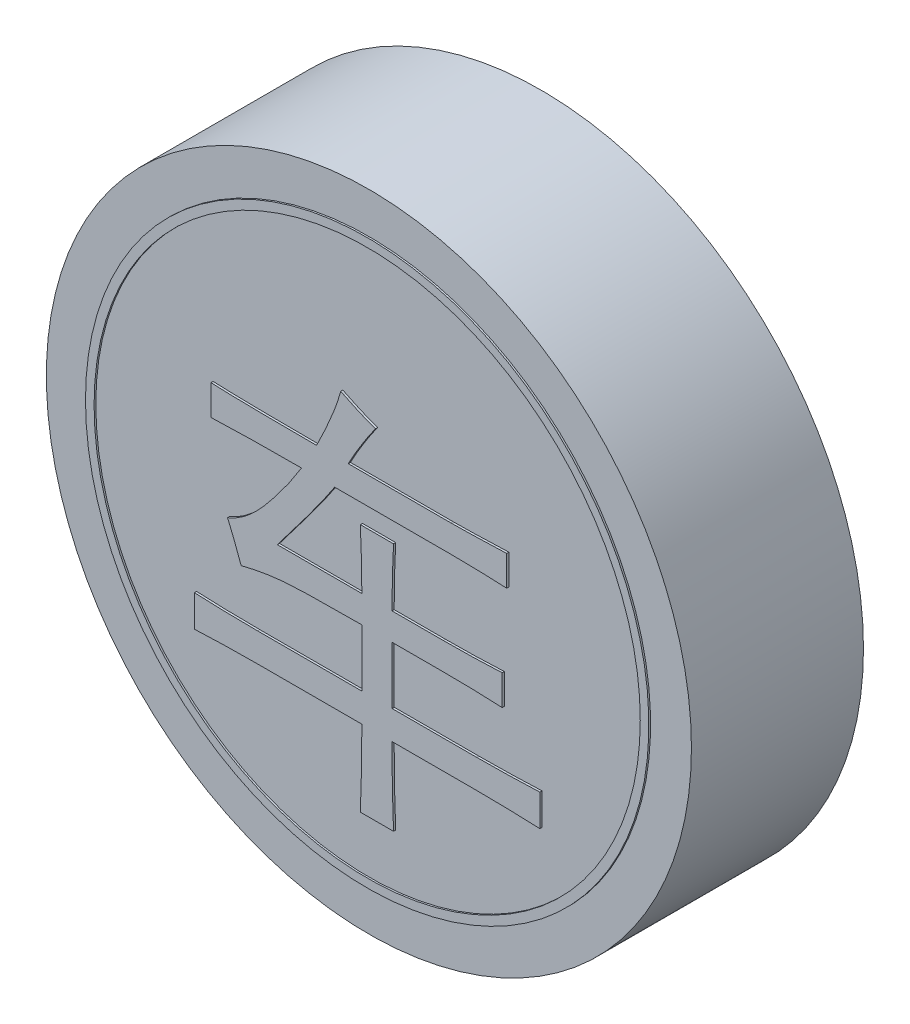
from build123d import *

# Parameters (mm, degrees)
SKETCH_1_R               = 15
DIAMETER30_HEIGHT8_DEPTH = 8
CHARACTER_DEPTH          = 0.1
SKETCH_3_R               = 13.1
SKETCH_3_R_2             = 12.7
INK_RING_DEPTH           = 0.08


with BuildPart() as part:
    # 草图1 → Diameter30_Height8 (new body)
    with BuildSketch(Plane.XY):
        Circle(SKETCH_1_R)
    extrude(amount=-DIAMETER30_HEIGHT8_DEPTH)

    # 草图2 → Character_车 (add)
    with BuildSketch(Plane.XY):
        with BuildLine():
            add(Edge.make_bspline(
                [(-5.842105263, -3.026315789), (-5.898820329, -2.869331425), (-6.006873714, -2.570245254), (-6.168804206, -2.144780878), (-6.320461844, -1.762772614), (-6.42455933, -1.524652502), (-6.473684211, -1.412280702)],
                knots=[0, 0, 0, 0, 1.155372541, 2.201212519, 3.151130129, 4, 4, 4, 4], degree=3))
            add(Edge.make_bspline(
                [(-6.473684211, -1.412280702), (-6.396823444, -1.379800087), (-6.239919961, -1.313494196), (-6.010146568, -1.186156652), (-5.778564765, -1.035723149), (-5.547823353, -0.856912408), (-5.313044861, -0.657208498), (-5.079209262, -0.430138074), (-4.845963085, -0.176973346), (-4.534501394, 0.18732381), (-4.164145867, 0.656391458), (-3.748633816, 1.216101595), (-3.371664409, 1.762234908), (-3.145394749, 2.128474715), (-3.035087719, 2.307017544)],
                knots=[0, 0, 0, 0, 0.584208733, 1.192603045, 1.837360117, 2.517159342, 3.236043131, 3.995784846, 4.79889664, 5.646810753, 7.353001509, 8.984483524, 10.529928116, 12, 12, 12, 12], degree=3))
            add(Edge.make_bspline(
                [(-3.035087719, 2.307017544), (-3.246482619, 2.307526273), (-3.658883418, 2.308518731), (-4.261856974, 2.301476847), (-4.833674599, 2.297370313), (-5.375169247, 2.289752816), (-5.886281193, 2.27816959), (-6.367224064, 2.269967872), (-6.816777836, 2.252736276), (-7.106129451, 2.242011892), (-7.245614035, 2.236842105)],
                knots=[0, 0, 0, 0, 1.204686206, 2.35016811, 3.436405474, 4.463457902, 5.436294372, 6.34989698, 7.204552796, 8, 8, 8, 8], degree=3))
            Line((-7.245614035, 2.236842105), (-7.245614035, 3.640350877))
            add(Edge.make_bspline(
                [(-7.245614035, 3.640350877), (-7.112197092, 3.635099441), (-6.825465539, 3.623813374), (-6.364629063, 3.606862837), (-5.842966328, 3.598841349), (-5.259942843, 3.587169275), (-4.61534822, 3.57975231), (-3.909248078, 3.575626696), (-3.141661522, 3.568632873), (-2.609705057, 3.569648027), (-2.333333333, 3.570175439)],
                knots=[0, 0, 0, 0, 0.652233806, 1.401741091, 2.25255631, 3.200691931, 4.250322975, 5.401478114, 6.649968519, 8, 8, 8, 8], degree=3))
            add(Edge.make_bspline(
                [(-2.333333333, 3.570175439), (-2.265182445, 3.706781651), (-2.13249513, 3.972749008), (-1.948730322, 4.364802108), (-1.781805751, 4.736299128), (-1.633474827, 5.088418502), (-1.500571846, 5.419860952), (-1.385562669, 5.732537711), (-1.288604233, 6.025373857), (-1.235803724, 6.215836544), (-1.210526316, 6.307017544)],
                knots=[0, 0, 0, 0, 1.236548776, 2.407515765, 3.506966959, 4.535340541, 5.502281012, 6.399229081, 7.23365623, 8, 8, 8, 8], degree=3))
            add(Edge.make_bspline(
                [(-1.210526316, 6.307017544), (-1.072464078, 6.238250423), (-0.801072324, 6.103073492), (-0.390506761, 5.92371698), (0.006858558, 5.752049753), (0.273104458, 5.653521307), (0.403508772, 5.605263158)],
                knots=[0, 0, 0, 0, 1.050893361, 2.065762486, 3.052631741, 4, 4, 4, 4], degree=3))
            add(Edge.make_bspline(
                [(0.403508772, 5.605263158), (0.287716291, 5.440743002), (0.057094455, 5.113071117), (-0.262779106, 4.605286149), (-0.575699306, 4.095748706), (-0.765073243, 3.745229449), (-0.859649123, 3.570175439)],
                knots=[0, 0, 0, 0, 1.007065107, 2.005753766, 3.00404673, 4, 4, 4, 4], degree=3))
            Line((-0.859649123, 3.570175439), (3.912280702, 3.570175439))
            add(Edge.make_bspline(
                [(3.912280702, 3.570175439), (3.986792128, 3.569779735), (4.146229603, 3.568933021), (4.399164705, 3.576215116), (4.681635542, 3.580205028), (4.991801347, 3.588183635), (5.330489118, 3.599673551), (5.697948203, 3.608156571), (6.093748619, 3.625727153), (6.367546823, 3.635374682), (6.50877193, 3.640350877)],
                knots=[0, 0, 0, 0, 0.688397439, 1.473013676, 2.337661006, 3.298515698, 4.339608953, 5.468714639, 6.694363069, 8, 8, 8, 8], degree=3))
            Line((6.50877193, 3.640350877), (6.50877193, 2.236842105))
            add(Edge.make_bspline(
                [(6.50877193, 2.236842105), (6.279214943, 2.247975922), (5.82888106, 2.269817709), (5.1668562, 2.289395513), (4.530922728, 2.303382911), (4.115883288, 2.305821342), (3.912280702, 2.307017544)],
                knots=[0, 0, 0, 0, 1.061662981, 2.082719505, 3.05945501, 4, 4, 4, 4], degree=3))
            Line((3.912280702, 2.307017544), (-1.49122807, 2.307017544))
            add(Edge.make_bspline(
                [(-1.49122807, 2.307017544), (-1.56117399, 2.201167925), (-1.710872673, 1.974627926), (-1.95506101, 1.616085811), (-2.235185889, 1.218787258), (-2.555254083, 0.784910796), (-2.903437302, 0.30729052), (-3.289360757, -0.207943656), (-3.711097719, -0.76191269), (-4.005224498, -1.143853854), (-4.157894737, -1.342105263)],
                knots=[0, 0, 0, 0, 0.673545103, 1.441525336, 2.302896076, 3.254132591, 4.303779702, 5.440759354, 6.671593656, 8, 8, 8, 8], degree=3))
            Line((-4.157894737, -1.342105263), (-0.228070175, -1.342105263))
            add(Edge.make_bspline(
                [(-0.228070175, -1.342105263), (-0.231461537, -0.891528138), (-0.238331174, 0.021173694), (-0.278106388, 0.933036802), (-0.298245614, 1.394736842)],
                knots=[0, 0, 0, 0, 0.987347913, 2, 2, 2, 2], degree=3))
            Line((-0.298245614, 1.394736842), (1.245614035, 1.394736842))
            add(Edge.make_bspline(
                [(1.245614035, 1.394736842), (1.234342441, 1.188579897), (1.211003525, 0.761712205), (1.192285381, 0.099612341), (1.178632375, -0.606505386), (1.176525709, -1.091718406), (1.175438596, -1.342105263)],
                knots=[0, 0, 0, 0, 0.904818853, 1.873514066, 2.902659025, 4, 4, 4, 4], degree=3))
            Line((1.175438596, -1.342105263), (3.561403509, -1.342105263))
            add(Edge.make_bspline(
                [(3.561403509, -1.342105263), (4.023251472, -1.338996907), (4.935977079, -1.332854028), (5.847809296, -1.292074512), (6.298245614, -1.271929825)],
                knots=[0, 0, 0, 0, 1.012019295, 2, 2, 2, 2], degree=3))
            Line((6.298245614, -1.271929825), (6.298245614, -2.675438596))
            add(Edge.make_bspline(
                [(6.298245614, -2.675438596), (5.847809296, -2.655293909), (4.935977079, -2.614514393), (4.023251472, -2.608371514), (3.561403509, -2.605263158)],
                knots=[0, 0, 0, 0, 0.987980705, 2, 2, 2, 2], degree=3))
            Line((3.561403509, -2.605263158), (1.175438596, -2.605263158))
            Line((1.175438596, -2.605263158), (1.175438596, -5.271929825))
            Line((1.175438596, -5.271929825), (5.105263158, -5.271929825))
            add(Edge.make_bspline(
                [(5.105263158, -5.271929825), (5.333122844, -5.270715306), (5.801003783, -5.268221447), (6.520106526, -5.254311899), (7.274811493, -5.234595053), (7.789282241, -5.212873368), (8.052631579, -5.201754386)],
                knots=[0, 0, 0, 0, 0.927389459, 1.904276523, 2.92723271, 4, 4, 4, 4], degree=3))
            Line((8.052631579, -5.201754386), (8.052631579, -6.675438596))
            add(Edge.make_bspline(
                [(8.052631579, -6.675438596), (7.789282241, -6.664319614), (7.274811493, -6.64259793), (6.520106526, -6.622881083), (5.801003783, -6.608971535), (5.333122844, -6.606477676), (5.105263158, -6.605263158)],
                knots=[0, 0, 0, 0, 1.07276729, 2.095723477, 3.072610541, 4, 4, 4, 4], degree=3))
            Line((5.105263158, -6.605263158), (1.175438596, -6.605263158))
            add(Edge.make_bspline(
                [(1.175438596, -6.605263158), (1.17492319, -6.788068469), (1.173921664, -7.143291287), (1.180988322, -7.662224869), (1.185055025, -8.151741366), (1.192680502, -8.613534144), (1.204276819, -9.04666503), (1.212388046, -9.451393023), (1.229724118, -9.827285169), (1.240445713, -10.06811771), (1.245614035, -10.184210526)],
                knots=[0, 0, 0, 0, 1.225493371, 2.381348807, 3.479127077, 4.507295234, 5.477513674, 6.383863443, 7.220944797, 8, 8, 8, 8], degree=3))
            Line((1.245614035, -10.184210526), (-0.298245614, -10.184210526))
            add(Edge.make_bspline(
                [(-0.298245614, -10.184210526), (-0.293088467, -10.062919018), (-0.28244323, -9.812552555), (-0.26517016, -9.425394066), (-0.256955584, -9.014609066), (-0.245308677, -8.579745809), (-0.237743343, -8.120551737), (-0.233625145, -7.637100266), (-0.226569426, -7.129429714), (-0.227561666, -6.782870303), (-0.228070175, -6.605263158)],
                knots=[0, 0, 0, 0, 0.813876, 1.679979569, 2.597948426, 3.568174058, 4.596349836, 5.676713029, 6.809345956, 8, 8, 8, 8], degree=3))
            Line((-0.228070175, -6.605263158), (-5.070175439, -6.605263158))
            add(Edge.make_bspline(
                [(-5.070175439, -6.605263158), (-5.324893201, -6.606388994), (-5.827429759, -6.608610173), (-6.573394245, -6.622429105), (-7.301292576, -6.641441143), (-7.781058, -6.664213602), (-8.01754386, -6.675438596)],
                knots=[0, 0, 0, 0, 1.036669794, 2.04526165, 3.036470834, 4, 4, 4, 4], degree=3))
            Line((-8.01754386, -6.675438596), (-8.01754386, -5.201754386))
            add(Edge.make_bspline(
                [(-8.01754386, -5.201754386), (-7.781058, -5.212979381), (-7.301292576, -5.235751839), (-6.573394245, -5.254763877), (-5.827429759, -5.268582809), (-5.324893201, -5.270803988), (-5.070175439, -5.271929825)],
                knots=[0, 0, 0, 0, 0.963529166, 1.95473835, 2.963330206, 4, 4, 4, 4], degree=3))
            Line((-5.070175439, -5.271929825), (-0.228070175, -5.271929825))
            Line((-0.228070175, -5.271929825), (-0.228070175, -2.605263158))
            add(Edge.make_bspline(
                [(-0.228070175, -2.605263158), (-0.430801667, -2.604732204), (-0.819811605, -2.603713387), (-1.378600845, -2.610674903), (-1.888907343, -2.614839935), (-2.351576194, -2.622216615), (-2.76650508, -2.633903903), (-3.133156573, -2.641670696), (-3.450969213, -2.659258343), (-3.813777921, -2.677582124), (-4.243119388, -2.723022723), (-4.761241386, -2.794248367), (-5.296964879, -2.896480162), (-5.65789017, -2.982441435), (-5.842105263, -3.026315789)],
                knots=[0, 0, 0, 0, 1.292465027, 2.480037691, 3.562671594, 4.545968376, 5.429981271, 6.209087619, 6.883751335, 7.459135407, 8.52479941, 9.634773871, 10.792796285, 12, 12, 12, 12], degree=3))
        make_face()
    extrude(amount=CHARACTER_DEPTH)

    # 草图3 → Ink_ring (add)
    with BuildSketch(Plane.XY):
        with Locations(Location((0, 0, 0), (0, 0, 180))):
            Circle(SKETCH_3_R)
        with Locations(Location((0, 0, 0), (0, 0, 180))):
            Circle(SKETCH_3_R_2, mode=Mode.SUBTRACT)
    extrude(amount=INK_RING_DEPTH)


solid = part.part
